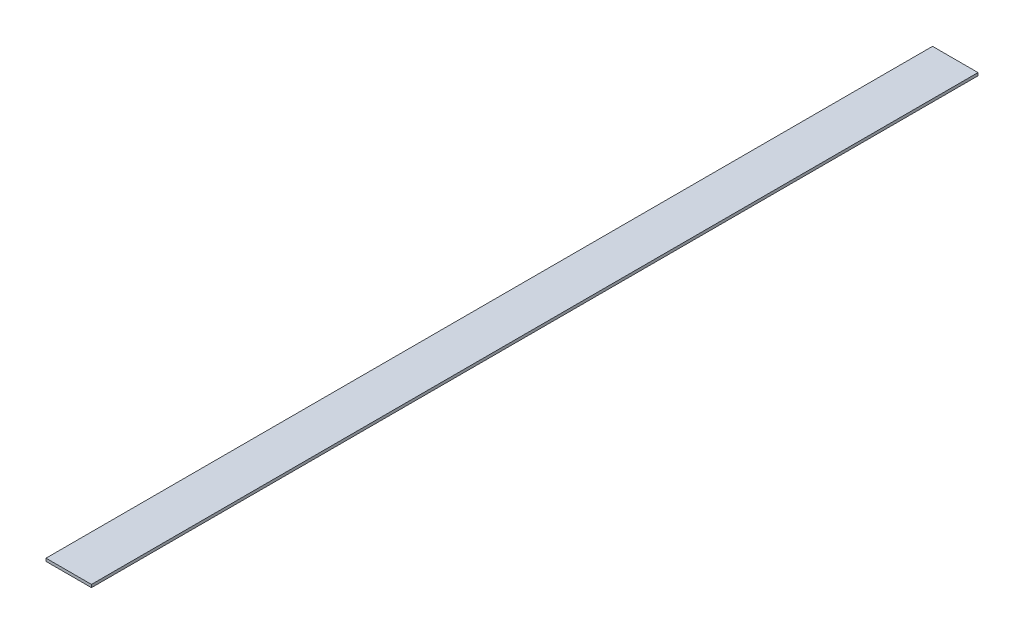
from build123d import *

# Parameters (mm, degrees)
SKETCH1_W           = 50.8
SKETCH1_H           = 990.6
BOSS_EXTRUDE1_DEPTH = 3.175


with BuildPart() as part:
    # Sketch1 → Boss-Extrude1 (new body)
    with BuildSketch(Plane(origin=(0, 0, 0), x_dir=(1, 0, 0), z_dir=(0, 1, 0))):
        Rectangle(SKETCH1_W, SKETCH1_H)
    extrude(amount=BOSS_EXTRUDE1_DEPTH)


solid = part.part
